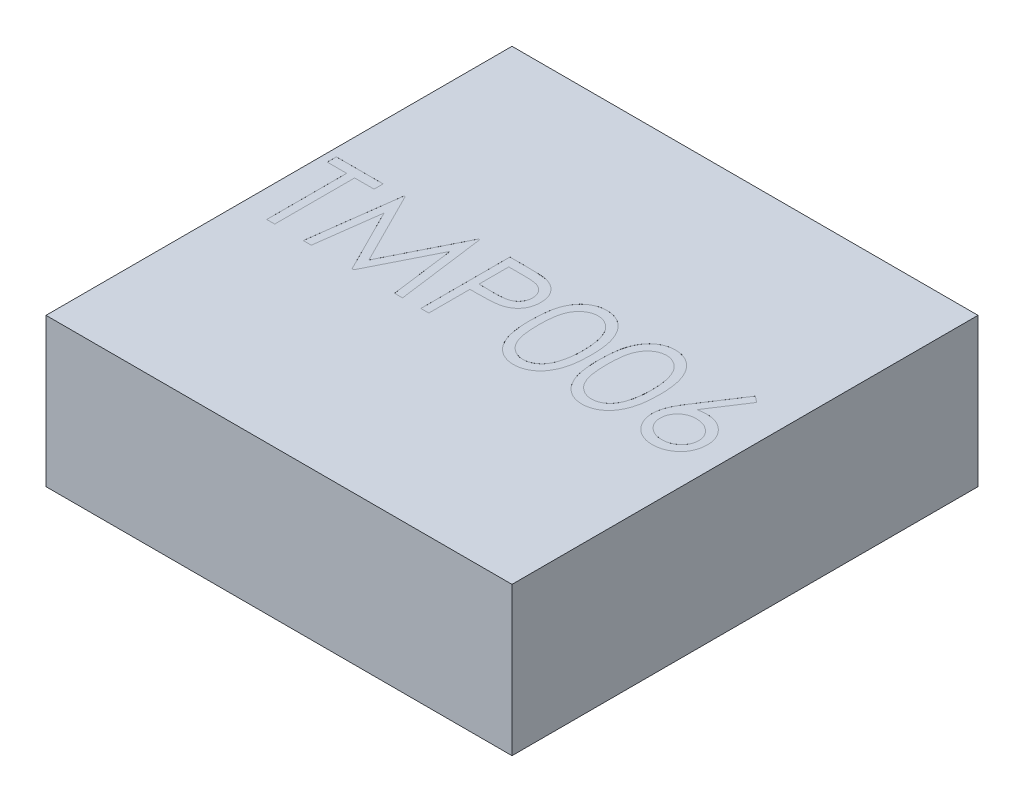
from build123d import *

# Parameters (mm, degrees)
SCHIZZO1_W                   = 1.57
SCHIZZO1_H                   = 1.57
ESTRUSIONE_ESTRUSIONE1_DEPTH = 0.5
TAGLIO_ESTRUSIONE1_DEPTH     = 0.0001


with BuildPart() as part:
    # Schizzo1 → Estrusione-Estrusione1 (new body)
    with BuildSketch(Plane(origin=(0, 0, 0), x_dir=(1, 0, 0), z_dir=(0, 1, 0))):
        with Locations((-21.346864873, 39.742181132)):
            Rectangle(SCHIZZO1_W, SCHIZZO1_H)
    extrude(amount=ESTRUSIONE_ESTRUSIONE1_DEPTH)

    # Schizzo2 → Taglio-Estrusione1 (cut)
    # profile 1 of 6: a face of its own
    with BuildSketch(Plane(origin=(0, 0.5, 0), x_dir=(1, 0, 0), z_dir=(0, 1, 0))):
        Polygon((-22.105112143, 39.877922201), (-22.105112143, 39.908691432), (-21.947419836, 39.908691432), (-21.947419836, 39.877922201), (-22.012804451, 39.877922201), (-22.012804451, 39.608691432), (-22.039727528, 39.608691432), (-22.039727528, 39.877922201), align=None)
    # profile 2 of 6: a face of its own
    with BuildSketch(Plane(origin=(0, 0.5, 0), x_dir=(1, 0, 0), z_dir=(0, 1, 0))):
        Polygon((-21.916650605, 39.608691432), (-21.877047239, 39.908691432), (-21.873201086, 39.908691432), (-21.749342912, 39.662537586), (-21.62578522, 39.908691432), (-21.62187897, 39.908691432), (-21.58203522, 39.608691432), (-21.609078489, 39.608691432), (-21.637804451, 39.824556817), (-21.74609772, 39.608691432), (-21.752167432, 39.608691432), (-21.860881374, 39.825037586), (-21.889547239, 39.608691432), align=None)
    # profile 3 of 6: a face of its own
    with BuildSketch(Plane(origin=(0, 0.5, 0), x_dir=(1, 0, 0), z_dir=(0, 1, 0))):
        with BuildLine():
            Line((-21.520496759, 39.908691432), (-21.461662624, 39.908691432))
            add(Edge.make_bspline(
                [(-21.461662624, 39.908691432), (-21.457615975, 39.908686984), (-21.449862415, 39.908678461), (-21.438743982, 39.908420054), (-21.428646005, 39.908074909), (-21.419590258, 39.907596461), (-21.411548878, 39.907031039), (-21.404558253, 39.906238007), (-21.398563434, 39.905409982), (-21.394971452, 39.904568147), (-21.393333297, 39.904184221)],
                knots=[0, 0, 0, 0, 1.415646017, 2.712440637, 3.8905458, 4.950247383, 5.884950622, 6.709939814, 7.411656543, 8, 8, 8, 8], degree=3))
            add(Edge.make_bspline(
                [(-21.393333297, 39.904184221), (-21.391259566, 39.903616625), (-21.387160968, 39.902494808), (-21.381255164, 39.900247918), (-21.375636263, 39.897583732), (-21.370284986, 39.894547394), (-21.365267094, 39.891008632), (-21.360507719, 39.887110893), (-21.356048863, 39.882764187), (-21.351915601, 39.878017267), (-21.348119761, 39.87294982), (-21.344851503, 39.8674862), (-21.342114883, 39.861718374), (-21.339767746, 39.855650354), (-21.33807845, 39.849231183), (-21.336805858, 39.842505465), (-21.335998119, 39.83547392), (-21.335920756, 39.830668789), (-21.335881374, 39.828222682)],
                knots=[0, 0, 0, 0, 0.999701418, 1.975846123, 2.934577507, 3.890451536, 4.834027766, 5.787354733, 6.749476667, 7.726910423, 8.712836071, 9.690891519, 10.682875813, 11.679750201, 12.712814741, 13.765529915, 14.8625177, 16, 16, 16, 16], degree=3))
            add(Edge.make_bspline(
                [(-21.335881374, 39.828222682), (-21.335917496, 39.825756016), (-21.335988171, 39.820929816), (-21.336836424, 39.813869291), (-21.337979012, 39.807122001), (-21.339735903, 39.800702905), (-21.34203696, 39.794650124), (-21.344736279, 39.788871162), (-21.34799201, 39.783464333), (-21.351732996, 39.778410008), (-21.355894561, 39.773703444), (-21.360459098, 39.769378748), (-21.365408181, 39.765461233), (-21.370726079, 39.761942118), (-21.376464637, 39.758903008), (-21.382536822, 39.756180953), (-21.388995412, 39.753894863), (-21.39346477, 39.752692286), (-21.395737143, 39.752080855)],
                knots=[0, 0, 0, 0, 1.121902311, 2.195077645, 3.232258892, 4.234102512, 5.217864754, 6.176164875, 7.132989551, 8.084763148, 9.034132444, 9.988522005, 10.94243251, 11.903244335, 12.886203696, 13.894208494, 14.929344452, 16, 16, 16, 16], degree=3))
            add(Edge.make_bspline(
                [(-21.395737143, 39.752080855), (-21.397616629, 39.751681171), (-21.401735631, 39.75080524), (-21.408519293, 39.749827372), (-21.416417469, 39.748992721), (-21.425419379, 39.748366909), (-21.435516942, 39.747831163), (-21.446715621, 39.747405327), (-21.459037399, 39.747171339), (-21.467632077, 39.747159271), (-21.472119355, 39.747152971)],
                knots=[0, 0, 0, 0, 0.601384939, 1.31797006, 2.144135048, 3.087295005, 4.142315834, 5.309527816, 6.595305764, 8, 8, 8, 8], degree=3))
            Line((-21.472119355, 39.747152971), (-21.493573682, 39.747152971))
            Line((-21.493573682, 39.747152971), (-21.493573682, 39.608691432))
            Line((-21.493573682, 39.608691432), (-21.520496759, 39.608691432))
            Line((-21.520496759, 39.608691432), (-21.520496759, 39.908691432))
        make_face()
        with BuildLine():
            Line((-21.493573682, 39.877922201), (-21.493573682, 39.777922201))
            Line((-21.493573682, 39.777922201), (-21.441049643, 39.777261144))
            add(Edge.make_bspline(
                [(-21.441049643, 39.777261144), (-21.438485078, 39.777259818), (-21.433534238, 39.777257259), (-21.426382562, 39.77759885), (-21.41974748, 39.777993181), (-21.413649374, 39.778570546), (-21.408085494, 39.779386654), (-21.403046562, 39.780210517), (-21.398571653, 39.781402406), (-21.393334578, 39.78300724), (-21.387498863, 39.785744321), (-21.381150216, 39.789717169), (-21.37576988, 39.79478123), (-21.371114026, 39.800475044), (-21.367419236, 39.806809255), (-21.364714437, 39.813586592), (-21.363125195, 39.820737551), (-21.362912092, 39.82563082), (-21.362804451, 39.82810249)],
                knots=[0, 0, 0, 0, 1.160613943, 2.240541288, 3.23993089, 4.169200891, 5.011653406, 5.7853311, 6.478053781, 7.106038997, 8.262395093, 9.384106736, 10.481365981, 11.59014053, 12.70357646, 13.786202915, 14.881775077, 16, 16, 16, 16], degree=3))
            add(Edge.make_bspline(
                [(-21.362804451, 39.82810249), (-21.362912678, 39.830514362), (-21.363127819, 39.835308867), (-21.364726893, 39.842335618), (-21.367413977, 39.849041535), (-21.371138828, 39.855296371), (-21.375659497, 39.860969697), (-21.380913726, 39.865898022), (-21.386889148, 39.869859882), (-21.392447568, 39.872417021), (-21.397384813, 39.87397833), (-21.401673266, 39.875070745), (-21.406515324, 39.87594294), (-21.411912562, 39.876649183), (-21.417823148, 39.877253765), (-21.424297861, 39.877663992), (-21.431312173, 39.877904117), (-21.436181651, 39.877916027), (-21.438705893, 39.877922201)],
                knots=[0, 0, 0, 0, 1.120700087, 2.227813068, 3.331159281, 4.466773991, 5.599788987, 6.693661531, 7.80175334, 8.91857717, 9.525282508, 10.207424825, 10.974604443, 11.810962634, 12.737642355, 13.736264703, 14.826523623, 16, 16, 16, 16], degree=3))
            Line((-21.438705893, 39.877922201), (-21.493573682, 39.877922201))
        make_face(mode=Mode.SUBTRACT)
    # profile 4 of 6: a face of its own
    with BuildSketch(Plane(origin=(0, 0.5, 0), x_dir=(1, 0, 0), z_dir=(0, 1, 0))):
        with BuildLine():
            add(Edge.make_bspline(
                [(-21.301265989, 39.75857124), (-21.301237874, 39.763379587), (-21.301183258, 39.772719872), (-21.300575679, 39.786329984), (-21.299566364, 39.799098009), (-21.298183161, 39.811024557), (-21.296499905, 39.822112708), (-21.294252864, 39.83233283), (-21.29169748, 39.841732225), (-21.288735842, 39.850341544), (-21.285394032, 39.858276775), (-21.281756809, 39.86568465), (-21.277679827, 39.872553958), (-21.273396092, 39.87899434), (-21.2687322, 39.884900371), (-21.263820875, 39.890355457), (-21.258470428, 39.895233521), (-21.252862742, 39.89967749), (-21.246947045, 39.903573159), (-21.240891959, 39.907004536), (-21.234655807, 39.909935954), (-21.228221563, 39.912240848), (-21.221647058, 39.914144635), (-21.21490931, 39.915446545), (-21.207997193, 39.916265708), (-21.203331641, 39.916344023), (-21.200965509, 39.91638374)],
                knots=[0, 0, 0, 0, 1.646270934, 3.197905019, 4.663502075, 6.030701355, 7.308322542, 8.50163776, 9.611534131, 10.641858119, 11.616356847, 12.558055219, 13.465016945, 14.349605745, 15.204443733, 16.039544428, 16.859896111, 17.680448484, 18.487036065, 19.28249412, 20.06191084, 20.843045899, 21.620316918, 22.403196591, 23.190181807, 24, 24, 24, 24], degree=3))
            add(Edge.make_bspline(
                [(-21.200965509, 39.91638374), (-21.19857961, 39.916341927), (-21.19383481, 39.916258775), (-21.18681992, 39.91545958), (-21.17996709, 39.914133483), (-21.173305536, 39.912254543), (-21.166780537, 39.909923485), (-21.160443131, 39.907001732), (-21.154253952, 39.903600686), (-21.148311356, 39.899604354), (-21.142550103, 39.89514873), (-21.137111706, 39.89011193), (-21.131995671, 39.884544811), (-21.127137787, 39.878506937), (-21.122675879, 39.871882501), (-21.118426728, 39.86478672), (-21.11462341, 39.857095503), (-21.110960438, 39.848937178), (-21.107798696, 39.840086007), (-21.104947304, 39.830591884), (-21.102643392, 39.820342668), (-21.100724312, 39.809392133), (-21.099237606, 39.797700063), (-21.098154809, 39.785291522), (-21.09758283, 39.772158345), (-21.097475113, 39.763179101), (-21.097419836, 39.75857124)],
                knots=[0, 0, 0, 0, 0.810914788, 1.612654377, 2.396697861, 3.181598691, 3.963628158, 4.749916497, 5.551656086, 6.361998678, 7.18212741, 8.025565596, 8.878627764, 9.750805457, 10.657531673, 11.591944965, 12.560506719, 13.57287815, 14.630710178, 15.753379473, 16.941251878, 18.199788006, 19.531962791, 20.947069417, 22.433333509, 24, 24, 24, 24], degree=3))
            add(Edge.make_bspline(
                [(-21.097419836, 39.75857124), (-21.097475686, 39.753983476), (-21.097584507, 39.745044406), (-21.098148396, 39.731970323), (-21.099259136, 39.719627633), (-21.100648564, 39.707986736), (-21.102572932, 39.697096083), (-21.104939089, 39.686917988), (-21.10756626, 39.677408496), (-21.110809242, 39.668645512), (-21.114358731, 39.660506793), (-21.118220605, 39.652906752), (-21.122358019, 39.645778212), (-21.126865626, 39.639178234), (-21.131670204, 39.633060063), (-21.136874586, 39.627531696), (-21.142332065, 39.622459924), (-21.148110272, 39.617946927), (-21.154145548, 39.613996801), (-21.160313468, 39.610464185), (-21.166723473, 39.607615669), (-21.173230297, 39.605169808), (-21.179927014, 39.603301198), (-21.186805276, 39.602009153), (-21.193830097, 39.601102995), (-21.198578802, 39.601033868), (-21.200965509, 39.600999124)],
                knots=[0, 0, 0, 0, 1.561518951, 3.042555995, 4.452378317, 5.7783523, 7.031515105, 8.214008947, 9.334062868, 10.386615937, 11.391082383, 12.354592575, 13.286541444, 14.194233754, 15.072674879, 15.931287219, 16.775624067, 17.606195743, 18.42308326, 19.229000347, 20.022332153, 20.807536673, 21.593273796, 22.3848459, 23.188221202, 24, 24, 24, 24], degree=3))
            add(Edge.make_bspline(
                [(-21.200965509, 39.600999124), (-21.203331575, 39.601039098), (-21.207996998, 39.601117917), (-21.214910063, 39.60193338), (-21.221619986, 39.603244423), (-21.22815988, 39.605080132), (-21.234563295, 39.607327118), (-21.240742977, 39.610254577), (-21.246767635, 39.613626068), (-21.252621197, 39.617465676), (-21.258193668, 39.621864677), (-21.263516406, 39.626730188), (-21.268455693, 39.632183623), (-21.273052902, 39.638138874), (-21.277422109, 39.644541151), (-21.281441198, 39.651477869), (-21.2851587, 39.658921521), (-21.288556713, 39.6669202), (-21.291569456, 39.675590622), (-21.294230688, 39.68503198), (-21.296331902, 39.695327606), (-21.298130441, 39.706394809), (-21.299581102, 39.718281146), (-21.300571473, 39.73099307), (-21.301183586, 39.744522659), (-21.30123802, 39.753802925), (-21.301265989, 39.75857124)],
                knots=[0, 0, 0, 0, 0.810891512, 1.598919785, 2.382837074, 3.152667961, 3.926044502, 4.706494248, 5.493654104, 6.291793342, 7.103789334, 7.925228297, 8.761435821, 9.622817696, 10.50288917, 11.416980706, 12.369136599, 13.353924996, 14.394355917, 15.514179734, 16.714354668, 17.994756427, 19.357759367, 20.818452758, 22.365282078, 24, 24, 24, 24], degree=3))
        make_face()
        with BuildLine():
            add(Edge.make_bspline(
                [(-21.274342912, 39.758691432), (-21.274332674, 39.754684401), (-21.274312804, 39.74690754), (-21.273793701, 39.735606689), (-21.273086538, 39.725066375), (-21.272174427, 39.715273215), (-21.270819888, 39.706260357), (-21.269302164, 39.697965812), (-21.267455184, 39.690433478), (-21.265269897, 39.683611665), (-21.262780832, 39.677384602), (-21.260063186, 39.671590212), (-21.257143696, 39.666160046), (-21.25387634, 39.66114288), (-21.250317906, 39.656522352), (-21.24654877, 39.65221668), (-21.242428262, 39.648376939), (-21.236727942, 39.64377178), (-21.229202529, 39.639012997), (-21.219720776, 39.634869047), (-21.209977766, 39.632264836), (-21.203364802, 39.631933657), (-21.200064066, 39.631768355)],
                knots=[0, 0, 0, 0, 1.459021318, 2.831673884, 4.118529203, 5.306027144, 6.411944654, 7.436330062, 8.375795394, 9.233974572, 10.042671642, 10.816086306, 11.563610507, 12.285937304, 12.993564865, 13.685989202, 14.367179055, 15.041617293, 16.353048772, 17.594441528, 18.799311195, 20, 20, 20, 20], degree=3))
            add(Edge.make_bspline(
                [(-21.200064066, 39.631768355), (-21.19674198, 39.631905308), (-21.190104667, 39.63217893), (-21.180407484, 39.634818822), (-21.170993461, 39.638801926), (-21.163615866, 39.643511712), (-21.158003077, 39.647996997), (-21.153981621, 39.65182111), (-21.150290588, 39.656103041), (-21.146789839, 39.660722981), (-21.143579061, 39.665769194), (-21.140659363, 39.671217415), (-21.137995076, 39.677082773), (-21.136477158, 39.681177322), (-21.135701086, 39.683270759)],
                knots=[0, 0, 0, 0, 1.353760809, 2.704726607, 4.075137775, 5.516104923, 6.260822281, 7.007110065, 7.778089737, 8.566572457, 9.372053459, 10.217411131, 11.088608312, 12, 12, 12, 12], degree=3))
            add(Edge.make_bspline(
                [(-21.135701086, 39.683270759), (-21.134796648, 39.685947594), (-21.132960253, 39.691382717), (-21.130593529, 39.699813887), (-21.128729638, 39.708659838), (-21.127052778, 39.717867705), (-21.12590823, 39.727505394), (-21.124986989, 39.737543084), (-21.124444359, 39.747988343), (-21.124377095, 39.755085057), (-21.124342912, 39.758691432)],
                knots=[0, 0, 0, 0, 0.884706709, 1.796334032, 2.740027952, 3.714592787, 4.726048262, 5.777819803, 6.87074269, 8, 8, 8, 8], degree=3))
            add(Edge.make_bspline(
                [(-21.124342912, 39.758691432), (-21.124390072, 39.762297224), (-21.124482325, 39.769350924), (-21.124834952, 39.779681054), (-21.125745544, 39.789492576), (-21.126756897, 39.798827759), (-21.128248088, 39.807634928), (-21.1298559, 39.815987812), (-21.132016004, 39.823782928), (-21.134323413, 39.831142321), (-21.136964304, 39.837982377), (-21.139871367, 39.844334987), (-21.142976089, 39.850230821), (-21.146348281, 39.855653701), (-21.149947911, 39.860627919), (-21.153869987, 39.865053742), (-21.157958933, 39.869068339), (-21.16368612, 39.873650845), (-21.171183917, 39.878323276), (-21.180513544, 39.882623198), (-21.190222456, 39.88509248), (-21.196785895, 39.885440625), (-21.200064066, 39.885614509)],
                knots=[0, 0, 0, 0, 1.31362396, 2.569729283, 3.763502607, 4.902122613, 5.988968491, 7.01645872, 7.998833611, 8.933434873, 9.825090667, 10.667526885, 11.477055099, 12.250526234, 12.991942729, 13.710640831, 14.402115721, 15.076753259, 16.378508321, 17.609869233, 18.806226677, 20, 20, 20, 20], degree=3))
            add(Edge.make_bspline(
                [(-21.200064066, 39.885614509), (-21.203382117, 39.885440385), (-21.210024263, 39.88509182), (-21.219834088, 39.882632398), (-21.229237318, 39.878345572), (-21.236715287, 39.873635369), (-21.242446469, 39.869149228), (-21.246482128, 39.865258961), (-21.250266086, 39.861003567), (-21.253751889, 39.856340546), (-21.257016685, 39.851329229), (-21.260015057, 39.845930192), (-21.262716543, 39.840116075), (-21.265209503, 39.833891809), (-21.267401456, 39.827070585), (-21.26920951, 39.819547529), (-21.270879829, 39.811279367), (-21.27206228, 39.802217694), (-21.27311346, 39.792422081), (-21.273789004, 39.781855454), (-21.27431454, 39.77053565), (-21.274333266, 39.762718579), (-21.274342912, 39.758691432)],
                knots=[0, 0, 0, 0, 1.207732386, 2.417664972, 3.655092373, 4.956220595, 5.625982001, 6.301752483, 6.994047911, 7.697131622, 8.419323945, 9.170223765, 9.943494443, 10.752040957, 11.610060368, 12.549350801, 13.567764191, 14.679664412, 15.874934091, 17.154273443, 18.533957287, 20, 20, 20, 20], degree=3))
        make_face(mode=Mode.SUBTRACT)
    # profile 5 of 6: a face of its own
    with BuildSketch(Plane(origin=(0, 0.5, 0), x_dir=(1, 0, 0), z_dir=(0, 1, 0))):
        with BuildLine():
            add(Edge.make_bspline(
                [(-21.070496759, 39.75857124), (-21.070468643, 39.763379587), (-21.070414027, 39.772719872), (-21.069806448, 39.786329984), (-21.068797133, 39.799098009), (-21.06741393, 39.811024557), (-21.065730674, 39.822112708), (-21.063483633, 39.83233283), (-21.06092825, 39.841732225), (-21.057966611, 39.850341544), (-21.054624801, 39.858276775), (-21.050987579, 39.86568465), (-21.046910596, 39.872553958), (-21.042626861, 39.87899434), (-21.037962969, 39.884900371), (-21.033051644, 39.890355457), (-21.027701198, 39.895233521), (-21.022093511, 39.89967749), (-21.016177814, 39.903573159), (-21.010122729, 39.907004536), (-21.003886577, 39.909935954), (-20.997452332, 39.912240848), (-20.990877827, 39.914144635), (-20.984140079, 39.915446545), (-20.977227962, 39.916265708), (-20.97256241, 39.916344023), (-20.970196278, 39.91638374)],
                knots=[0, 0, 0, 0, 1.646270934, 3.197905019, 4.663502075, 6.030701355, 7.308322542, 8.50163776, 9.611534131, 10.641858119, 11.616356847, 12.558055219, 13.465016945, 14.349605745, 15.204443733, 16.039544428, 16.859896111, 17.680448484, 18.487036065, 19.28249412, 20.06191084, 20.843045899, 21.620316918, 22.403196591, 23.190181807, 24, 24, 24, 24], degree=3))
            add(Edge.make_bspline(
                [(-20.970196278, 39.91638374), (-20.96781038, 39.916341927), (-20.963065579, 39.916258775), (-20.95605069, 39.91545958), (-20.94919786, 39.914133483), (-20.942536305, 39.912254543), (-20.936011306, 39.909923485), (-20.9296739, 39.907001732), (-20.923484721, 39.903600686), (-20.917542125, 39.899604354), (-20.911780873, 39.89514873), (-20.906342476, 39.89011193), (-20.90122644, 39.884544811), (-20.896368556, 39.878506937), (-20.891906648, 39.871882501), (-20.887657497, 39.86478672), (-20.883854179, 39.857095503), (-20.880191207, 39.848937178), (-20.877029466, 39.840086007), (-20.874178073, 39.830591884), (-20.871874161, 39.820342668), (-20.869955081, 39.809392133), (-20.868468376, 39.797700063), (-20.867385578, 39.785291522), (-20.866813599, 39.772158345), (-20.866705882, 39.763179101), (-20.866650605, 39.75857124)],
                knots=[0, 0, 0, 0, 0.810914788, 1.612654377, 2.396697861, 3.181598691, 3.963628158, 4.749916497, 5.551656086, 6.361998678, 7.18212741, 8.025565596, 8.878627764, 9.750805457, 10.657531673, 11.591944965, 12.560506719, 13.57287815, 14.630710178, 15.753379473, 16.941251878, 18.199788006, 19.531962791, 20.947069417, 22.433333509, 24, 24, 24, 24], degree=3))
            add(Edge.make_bspline(
                [(-20.866650605, 39.75857124), (-20.866706455, 39.753983476), (-20.866815276, 39.745044406), (-20.867379166, 39.731970323), (-20.868489905, 39.719627633), (-20.869879333, 39.707986736), (-20.871803701, 39.697096083), (-20.874169858, 39.686917988), (-20.876797029, 39.677408496), (-20.880040011, 39.668645512), (-20.883589501, 39.660506793), (-20.887451375, 39.652906752), (-20.891588788, 39.645778212), (-20.896096395, 39.639178234), (-20.900900973, 39.633060063), (-20.906105355, 39.627531696), (-20.911562834, 39.622459924), (-20.917341041, 39.617946927), (-20.923376317, 39.613996801), (-20.929544238, 39.610464185), (-20.935954242, 39.607615669), (-20.942461067, 39.605169808), (-20.949157784, 39.603301198), (-20.956036046, 39.602009153), (-20.963060866, 39.601102995), (-20.967809571, 39.601033868), (-20.970196278, 39.600999124)],
                knots=[0, 0, 0, 0, 1.561518951, 3.042555995, 4.452378317, 5.7783523, 7.031515105, 8.214008947, 9.334062868, 10.386615937, 11.391082383, 12.354592575, 13.286541444, 14.194233754, 15.072674879, 15.931287219, 16.775624067, 17.606195743, 18.42308326, 19.229000347, 20.022332153, 20.807536673, 21.593273796, 22.3848459, 23.188221202, 24, 24, 24, 24], degree=3))
            add(Edge.make_bspline(
                [(-20.970196278, 39.600999124), (-20.972562345, 39.601039098), (-20.977227767, 39.601117917), (-20.984140832, 39.60193338), (-20.990850756, 39.603244423), (-20.997390649, 39.605080132), (-21.003794064, 39.607327118), (-21.009973746, 39.610254577), (-21.015998405, 39.613626068), (-21.021851967, 39.617465676), (-21.027424438, 39.621864677), (-21.032747175, 39.626730188), (-21.037686463, 39.632183623), (-21.042283671, 39.638138874), (-21.046652878, 39.644541151), (-21.050671967, 39.651477869), (-21.054389469, 39.658921521), (-21.057787483, 39.6669202), (-21.060800225, 39.675590622), (-21.063461457, 39.68503198), (-21.065562671, 39.695327606), (-21.06736121, 39.706394809), (-21.068811871, 39.718281146), (-21.069802242, 39.73099307), (-21.070414355, 39.744522659), (-21.070468789, 39.753802925), (-21.070496759, 39.75857124)],
                knots=[0, 0, 0, 0, 0.810891512, 1.598919785, 2.382837074, 3.152667961, 3.926044502, 4.706494248, 5.493654104, 6.291793342, 7.103789334, 7.925228297, 8.761435821, 9.622817696, 10.50288917, 11.416980706, 12.369136599, 13.353924996, 14.394355917, 15.514179734, 16.714354668, 17.994756427, 19.357759367, 20.818452758, 22.365282078, 24, 24, 24, 24], degree=3))
        make_face()
        with BuildLine():
            add(Edge.make_bspline(
                [(-21.043573682, 39.758691432), (-21.043563443, 39.754684401), (-21.043543573, 39.74690754), (-21.04302447, 39.735606689), (-21.042317307, 39.725066375), (-21.041405196, 39.715273215), (-21.040050657, 39.706260357), (-21.038532933, 39.697965812), (-21.036685954, 39.690433478), (-21.034500666, 39.683611665), (-21.032011601, 39.677384602), (-21.029293956, 39.671590212), (-21.026374465, 39.666160046), (-21.023107109, 39.66114288), (-21.019548675, 39.656522352), (-21.015779539, 39.65221668), (-21.011659032, 39.648376939), (-21.005958711, 39.64377178), (-20.998433299, 39.639012997), (-20.988951545, 39.634869047), (-20.979208535, 39.632264836), (-20.972595571, 39.631933657), (-20.969294836, 39.631768355)],
                knots=[0, 0, 0, 0, 1.459021318, 2.831673884, 4.118529203, 5.306027144, 6.411944654, 7.436330062, 8.375795394, 9.233974572, 10.042671642, 10.816086306, 11.563610507, 12.285937304, 12.993564865, 13.685989202, 14.367179055, 15.041617293, 16.353048772, 17.594441528, 18.799311195, 20, 20, 20, 20], degree=3))
            add(Edge.make_bspline(
                [(-20.969294836, 39.631768355), (-20.965972749, 39.631905308), (-20.959335436, 39.63217893), (-20.949638254, 39.634818822), (-20.94022423, 39.638801926), (-20.932846635, 39.643511712), (-20.927233846, 39.647996997), (-20.92321239, 39.65182111), (-20.919521357, 39.656103041), (-20.916020608, 39.660722981), (-20.91280983, 39.665769194), (-20.909890132, 39.671217415), (-20.907225845, 39.677082773), (-20.905707927, 39.681177322), (-20.904931855, 39.683270759)],
                knots=[0, 0, 0, 0, 1.353760809, 2.704726607, 4.075137775, 5.516104923, 6.260822281, 7.007110065, 7.778089737, 8.566572457, 9.372053459, 10.217411131, 11.088608312, 12, 12, 12, 12], degree=3))
            add(Edge.make_bspline(
                [(-20.904931855, 39.683270759), (-20.904027417, 39.685947594), (-20.902191022, 39.691382717), (-20.899824299, 39.699813887), (-20.897960407, 39.708659838), (-20.896283547, 39.717867705), (-20.895139, 39.727505394), (-20.894217758, 39.737543084), (-20.893675128, 39.747988343), (-20.893607864, 39.755085057), (-20.893573682, 39.758691432)],
                knots=[0, 0, 0, 0, 0.884706709, 1.796334032, 2.740027952, 3.714592787, 4.726048262, 5.777819803, 6.87074269, 8, 8, 8, 8], degree=3))
            add(Edge.make_bspline(
                [(-20.893573682, 39.758691432), (-20.893620841, 39.762297224), (-20.893713094, 39.769350924), (-20.894065721, 39.779681054), (-20.894976314, 39.789492576), (-20.895987667, 39.798827759), (-20.897478857, 39.807634928), (-20.899086669, 39.815987812), (-20.901246773, 39.823782928), (-20.903554182, 39.831142321), (-20.906195073, 39.837982377), (-20.909102136, 39.844334987), (-20.912206858, 39.850230821), (-20.91557905, 39.855653701), (-20.91917868, 39.860627919), (-20.923100756, 39.865053742), (-20.927189702, 39.869068339), (-20.93291689, 39.873650845), (-20.940414686, 39.878323276), (-20.949744313, 39.882623198), (-20.959453225, 39.88509248), (-20.966016664, 39.885440625), (-20.969294836, 39.885614509)],
                knots=[0, 0, 0, 0, 1.31362396, 2.569729283, 3.763502607, 4.902122613, 5.988968491, 7.01645872, 7.998833611, 8.933434873, 9.825090667, 10.667526885, 11.477055099, 12.250526234, 12.991942729, 13.710640831, 14.402115721, 15.076753259, 16.378508321, 17.609869233, 18.806226677, 20, 20, 20, 20], degree=3))
            add(Edge.make_bspline(
                [(-20.969294836, 39.885614509), (-20.972612886, 39.885440385), (-20.979255032, 39.88509182), (-20.989064857, 39.882632398), (-20.998468087, 39.878345572), (-21.005946057, 39.873635369), (-21.011677238, 39.869149228), (-21.015712898, 39.865258961), (-21.019496855, 39.861003567), (-21.022982658, 39.856340546), (-21.026247454, 39.851329229), (-21.029245826, 39.845930192), (-21.031947312, 39.840116075), (-21.034440272, 39.833891809), (-21.036632225, 39.827070585), (-21.038440279, 39.819547529), (-21.040110598, 39.811279367), (-21.04129305, 39.802217694), (-21.042344229, 39.792422081), (-21.043019773, 39.781855454), (-21.043545309, 39.77053565), (-21.043564035, 39.762718579), (-21.043573682, 39.758691432)],
                knots=[0, 0, 0, 0, 1.207732386, 2.417664972, 3.655092373, 4.956220595, 5.625982001, 6.301752483, 6.994047911, 7.697131622, 8.419323945, 9.170223765, 9.943494443, 10.752040957, 11.610060368, 12.549350801, 13.567764191, 14.679664412, 15.874934091, 17.154273443, 18.533957287, 20, 20, 20, 20], degree=3))
        make_face(mode=Mode.SUBTRACT)
    # profile 6 of 6: a face of its own
    with BuildSketch(Plane(origin=(0, 0.5, 0), x_dir=(1, 0, 0), z_dir=(0, 1, 0))):
        with BuildLine():
            Line((-20.701265989, 39.91638374), (-20.680532816, 39.900097682))
            Line((-20.680532816, 39.900097682), (-20.759799643, 39.77888374))
            add(Edge.make_bspline(
                [(-20.759799643, 39.77888374), (-20.754522191, 39.779724928), (-20.744227923, 39.78136576), (-20.733807989, 39.781636441), (-20.728729932, 39.781768355)],
                knots=[0, 0, 0, 0, 1.025318673, 2, 2, 2, 2], degree=3))
            add(Edge.make_bspline(
                [(-20.728729932, 39.781768355), (-20.725680861, 39.781686403), (-20.719678855, 39.781525082), (-20.710866843, 39.780283609), (-20.70239922, 39.778327171), (-20.694311082, 39.775475263), (-20.686573398, 39.771832204), (-20.679141764, 39.767466015), (-20.672155877, 39.762151243), (-20.665525776, 39.756214247), (-20.659506311, 39.749638505), (-20.654176934, 39.742661248), (-20.649700352, 39.735289743), (-20.646068302, 39.727527726), (-20.643247884, 39.719387161), (-20.6411918, 39.710878464), (-20.639976406, 39.701995766), (-20.639811364, 39.69595478), (-20.639727528, 39.692886144)],
                knots=[0, 0, 0, 0, 1.04369286, 2.054478336, 3.041073146, 4.015093852, 4.984733326, 5.965804835, 6.960378782, 7.985147595, 9.009457201, 10.008161701, 10.986880575, 11.956520048, 12.937015923, 13.931873656, 14.949455224, 16, 16, 16, 16], degree=3))
            add(Edge.make_bspline(
                [(-20.639727528, 39.692886144), (-20.639849508, 39.688687883), (-20.640089537, 39.680426701), (-20.642481291, 39.668394411), (-20.646197832, 39.656931624), (-20.651510191, 39.646221353), (-20.658108681, 39.636278275), (-20.666155332, 39.627468092), (-20.675364774, 39.619610661), (-20.685777928, 39.613040093), (-20.696984468, 39.607674117), (-20.708757496, 39.603819954), (-20.72098268, 39.601447085), (-20.729280218, 39.601149605), (-20.733477528, 39.600999124)],
                knots=[0, 0, 0, 0, 1.031375318, 2.029502543, 3.004789286, 3.987476834, 4.960371455, 5.9300674, 6.912260825, 7.929083631, 8.949397511, 9.960523116, 10.96833055, 12, 12, 12, 12], degree=3))
            add(Edge.make_bspline(
                [(-20.733477528, 39.600999124), (-20.737514388, 39.601130114), (-20.745510701, 39.60138958), (-20.757273512, 39.603700946), (-20.768576056, 39.607447269), (-20.779339146, 39.612608493), (-20.789309484, 39.61912774), (-20.798229396, 39.626975935), (-20.806054405, 39.635985318), (-20.812566515, 39.646154491), (-20.81773155, 39.657082201), (-20.821604972, 39.668476815), (-20.823867507, 39.680296813), (-20.824183669, 39.688309482), (-20.824342912, 39.692345278)],
                knots=[0, 0, 0, 0, 1.012016664, 2.004627821, 2.994792927, 3.992885782, 4.990978636, 5.973936114, 6.964471063, 7.975201453, 8.993600317, 9.990122807, 10.98767138, 12, 12, 12, 12], degree=3))
            add(Edge.make_bspline(
                [(-20.824342912, 39.692345278), (-20.824241646, 39.695434814), (-20.824034878, 39.701743056), (-20.822591159, 39.711297115), (-20.82027132, 39.721072922), (-20.817673299, 39.729366139), (-20.814928246, 39.736159983), (-20.812643743, 39.741637426), (-20.809800258, 39.747274089), (-20.806768253, 39.753263258), (-20.803274808, 39.759450581), (-20.799476323, 39.765939467), (-20.795267782, 39.772626717), (-20.792317482, 39.777164791), (-20.790809259, 39.779484701)],
                knots=[0, 0, 0, 0, 1.173818275, 2.396712641, 3.66331629, 4.989737886, 5.693666774, 6.447286557, 7.243889047, 8.091586357, 8.998013824, 9.943181721, 10.948533338, 12, 12, 12, 12], degree=3))
            Line((-20.790809259, 39.779484701), (-20.701265989, 39.91638374))
        make_face()
        with BuildLine():
            add(Edge.make_bspline(
                [(-20.73437897, 39.750999124), (-20.736664305, 39.750932435), (-20.741128229, 39.750802171), (-20.747677436, 39.750045721), (-20.753875715, 39.74862123), (-20.759805183, 39.746806973), (-20.765354986, 39.744312425), (-20.770565458, 39.74128227), (-20.775456749, 39.737714741), (-20.779977624, 39.733660377), (-20.784076453, 39.729221403), (-20.787606264, 39.724466872), (-20.790651041, 39.719511369), (-20.793126626, 39.714313488), (-20.795054346, 39.708875217), (-20.796448768, 39.703221567), (-20.797224804, 39.697314627), (-20.797353909, 39.693308983), (-20.797419836, 39.691263548)],
                knots=[0, 0, 0, 0, 1.129588631, 2.206414736, 3.251139165, 4.268635594, 5.265702196, 6.250456724, 7.242448911, 8.251968645, 9.246821453, 10.222880186, 11.173611482, 12.116736599, 13.062300278, 14.020270554, 14.989073742, 16, 16, 16, 16], degree=3))
            add(Edge.make_bspline(
                [(-20.797419836, 39.691263548), (-20.797366147, 39.689236406), (-20.797260873, 39.685261484), (-20.79630496, 39.67940384), (-20.79484481, 39.673766848), (-20.792672776, 39.668379568), (-20.7900819, 39.663159884), (-20.786661443, 39.65829686), (-20.782871433, 39.653495139), (-20.778341096, 39.649123585), (-20.773479094, 39.645055874), (-20.768284705, 39.641500424), (-20.762870994, 39.638458752), (-20.757164872, 39.636074943), (-20.751247296, 39.634118576), (-20.745068963, 39.632741878), (-20.738625575, 39.631963547), (-20.734260838, 39.631834273), (-20.73203522, 39.631768355)],
                knots=[0, 0, 0, 0, 0.989467248, 1.94019797, 2.891935182, 3.827694429, 4.772920941, 5.730924762, 6.725747692, 7.756678648, 8.79901574, 9.819492441, 10.826891316, 11.826466727, 12.835195252, 13.867842842, 14.912794438, 16, 16, 16, 16], degree=3))
            add(Edge.make_bspline(
                [(-20.73203522, 39.631768355), (-20.729809606, 39.631834278), (-20.725444876, 39.631963562), (-20.719001436, 39.632741819), (-20.712823295, 39.634118789), (-20.706905022, 39.63607417), (-20.701201471, 39.638461622), (-20.695792495, 39.641481501), (-20.69064723, 39.645077739), (-20.685782036, 39.649116633), (-20.681270555, 39.65352002), (-20.677389646, 39.658253997), (-20.67407394, 39.663199188), (-20.671379581, 39.668359007), (-20.66923147, 39.673770106), (-20.667763916, 39.679402968), (-20.666809977, 39.685261713), (-20.666704431, 39.689236484), (-20.666650605, 39.691263548)],
                knots=[0, 0, 0, 0, 1.087397944, 2.132534446, 3.165364764, 4.174271784, 5.174024072, 6.181601208, 7.194203697, 8.236725232, 9.267838612, 10.269026844, 11.221737037, 12.171628256, 13.107553087, 14.05945871, 15.010357665, 16, 16, 16, 16], degree=3))
            add(Edge.make_bspline(
                [(-20.666650605, 39.691263548), (-20.666697773, 39.693311652), (-20.666790348, 39.697331415), (-20.667837429, 39.703218925), (-20.669289633, 39.708903943), (-20.671482464, 39.714350738), (-20.674331311, 39.719537818), (-20.677801317, 39.724491383), (-20.681815537, 39.729249413), (-20.686452469, 39.733669082), (-20.691500204, 39.737710261), (-20.696867254, 39.741277651), (-20.702482223, 39.744288363), (-20.708339418, 39.746800401), (-20.714505951, 39.748613213), (-20.720882266, 39.750040634), (-20.727549915, 39.750800235), (-20.732073624, 39.750931984), (-20.73437897, 39.750999124)],
                knots=[0, 0, 0, 0, 0.978206639, 1.919901502, 2.851605144, 3.780102724, 4.718870031, 5.675451981, 6.667674623, 7.690630536, 8.733308323, 9.756129687, 10.767539656, 11.776269907, 12.797430371, 13.836405707, 14.897401972, 16, 16, 16, 16], degree=3))
        make_face(mode=Mode.SUBTRACT)
    extrude(amount=-TAGLIO_ESTRUSIONE1_DEPTH, mode=Mode.SUBTRACT)


solid = part.part
